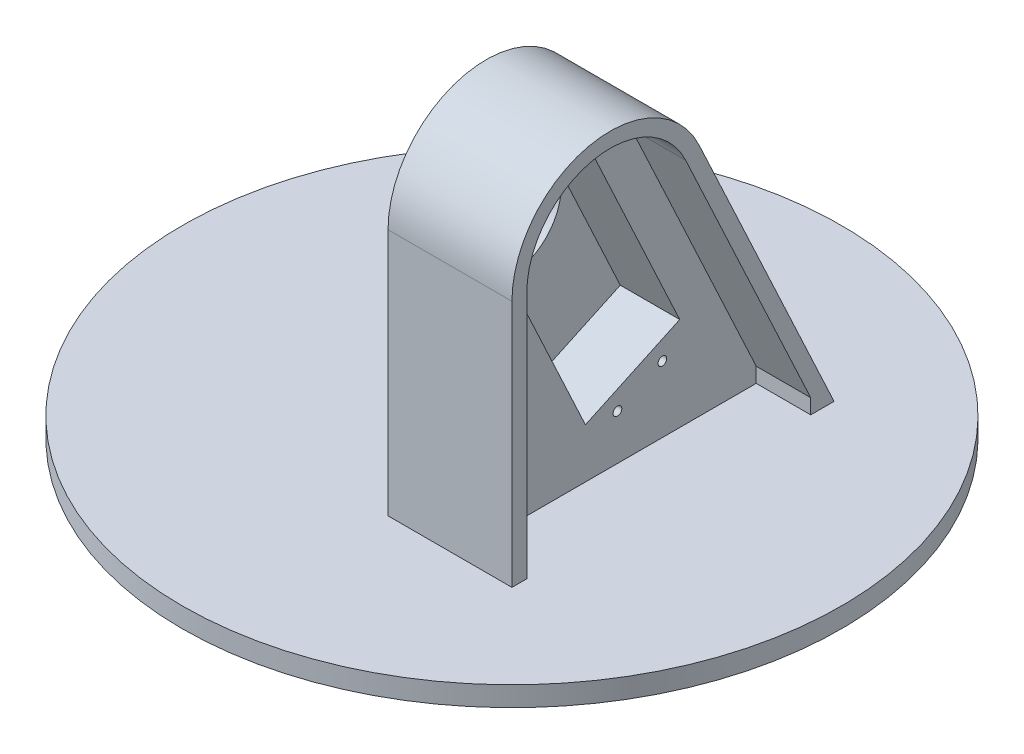
from build123d import *

# Parameters (mm, degrees)
SKETCH1_R           = 66.5
SKETCH1_R_2         = 3.75
SKETCH1_R_3         = 0.875
BOSS_EXTRUDE1_DEPTH = 4
BOSS_EXTRUDE2_DEPTH = 25
CUT_EXTRUDE1_DEPTH  = 11
CUT_EXTRUDE2_DEPTH  = 12
SKETCH6_3_R         = 0.875
CUT_EXTRUDE3_DEPTH  = 8
SKETCH7_R           = 10.5
CUT_EXTRUDE4_DEPTH  = 122.239616981
SKETCH8_W           = 7.5
SKETCH8_H           = 10
BOSS_EXTRUDE3_DEPTH = 8
SKETCH9_W           = 6
SKETCH9_H           = 4
CUT_EXTRUDE5_DEPTH  = 8
CUT_EXTRUDE6_REACH  = 114.543
SKETCH10_W          = 7.5
SKETCH10_H          = 2


with BuildPart() as part:
    # Sketch1 → Boss-Extrude1 (new body)
    with BuildSketch(Plane(origin=(0, 0, 0), x_dir=(1, 0, 0), z_dir=(0, 1, 0))):
        Circle(SKETCH1_R)
        Circle(SKETCH1_R_2, mode=Mode.SUBTRACT)
        with Locations((0, -7.25)):
            Circle(SKETCH1_R_3, mode=Mode.SUBTRACT)
        with Locations((0, 7.25)):
            Circle(SKETCH1_R_3, mode=Mode.SUBTRACT)
    extrude(amount=-BOSS_EXTRUDE1_DEPTH)

    # Sketch4 → Boss-Extrude2 (add)
    with BuildSketch(Plane(origin=(5, 0, 0), x_dir=(0, 0, -1), z_dir=(1, 0, 0))):
        with BuildLine():
            Line((0, 0), (35, 0))
            Line((35, 0), (7.77909307, 58.375423293))
            ThreePointArc((7.77909307, 58.375423293), (-14.471447396, 69.348175551), (-30, 50))
            Line((-30, 50), (-30, 0))
            Line((-30, 0), (0, 0))
        make_face()
    extrude(amount=BOSS_EXTRUDE2_DEPTH)

    # Sketch5 → Cut-Extrude1 (cut)
    with BuildSketch(Plane(origin=(30, 0, 0), x_dir=(0, 0, -1), z_dir=(1, 0, 0))):
        with BuildLine():
            Line((-27, 3), (-27, 0))
            Line((-27, 0), (30.290943269, 0))
            Line((30.290943269, 0), (30.290943269, 3))
            Line((30.290943269, 3), (5.060169709, 57.107568508))
            ThreePointArc((5.060169709, 57.107568508), (-13.822128554, 66.419287529), (-27, 50))
            Line((-27, 50), (-27, 3))
        make_face()
    extrude(amount=-CUT_EXTRUDE1_DEPTH, mode=Mode.SUBTRACT)

    # Sketch6 → Cut-Extrude2 (cut)
    with BuildSketch(Plane(origin=(19, 0, 0), x_dir=(0, 0, -1), z_dir=(1, 0, 0))):
        Polygon((-21.5, 47.158619269), (-4.172651269, 10), (14.859812259, 18.874983497), (-2.467536472, 56.033602765), align=None)
    extrude(amount=-CUT_EXTRUDE2_DEPTH, mode=Mode.SUBTRACT)

    # Sketch6<3> → Cut-Extrude3 (cut)
    with BuildSketch(Plane(origin=(19, 0, 0), x_dir=(0, 0, -1), z_dir=(1, 0, 0))):
        with Locations((-17.994471087, 52.655096963)):
            Circle(SKETCH6_3_R)
        with Locations((-8.931393217, 56.88127958)):
            Circle(SKETCH6_3_R)
        with Locations((11.354283347, 13.378505802)):
            Circle(SKETCH6_3_R)
        with Locations((2.291205476, 9.152323185)):
            Circle(SKETCH6_3_R)
    extrude(amount=-CUT_EXTRUDE3_DEPTH, mode=Mode.SUBTRACT)

    # Sketch7 → Cut-Extrude4 (cut, through all)
    with BuildSketch(Plane(origin=(7, 0, 0), x_dir=(0, 0, -1), z_dir=(1, 0, 0))):
        with Locations((-7.546276488, 42.079879253)):
            Circle(SKETCH7_R)
    extrude(amount=-CUT_EXTRUDE4_DEPTH, mode=Mode.SUBTRACT)

    # Sketch8 → Boss-Extrude3 (add)
    with BuildSketch(Plane(origin=(0, 0, 0), x_dir=(1, 0, 0), z_dir=(0, 1, 0))):
        with Locations((-3.75, 32)):
            Rectangle(SKETCH8_W, SKETCH8_H)
    extrude(amount=BOSS_EXTRUDE3_DEPTH)

    # Sketch9 → Cut-Extrude5 (cut)
    with BuildSketch(Plane.ZY.offset(7.5)):
        with Locations((-32, 4)):
            Rectangle(SKETCH9_W, SKETCH9_H)
    extrude(amount=-CUT_EXTRUDE5_DEPTH, mode=Mode.SUBTRACT)

    # Sketch10 → Cut-Extrude6 (cut, up to next)
    with BuildSketch(Plane(origin=(0, 8, 0), x_dir=(1, 0, 0), z_dir=(0, 1, 0)), mode=Mode.PRIVATE) as cut_extrude6_sk1:
        with Locations((-3.75, 34)):
            Rectangle(SKETCH10_W, SKETCH10_H)
    cut_extrude6_tool1 = extrude(cut_extrude6_sk1.sketch, amount=-CUT_EXTRUDE6_REACH, mode=Mode.PRIVATE) & part.part
    add(cut_extrude6_tool1.solids().sort_by_distance((-3.75, 8, -34))[0], mode=Mode.SUBTRACT)


solid = part.part
